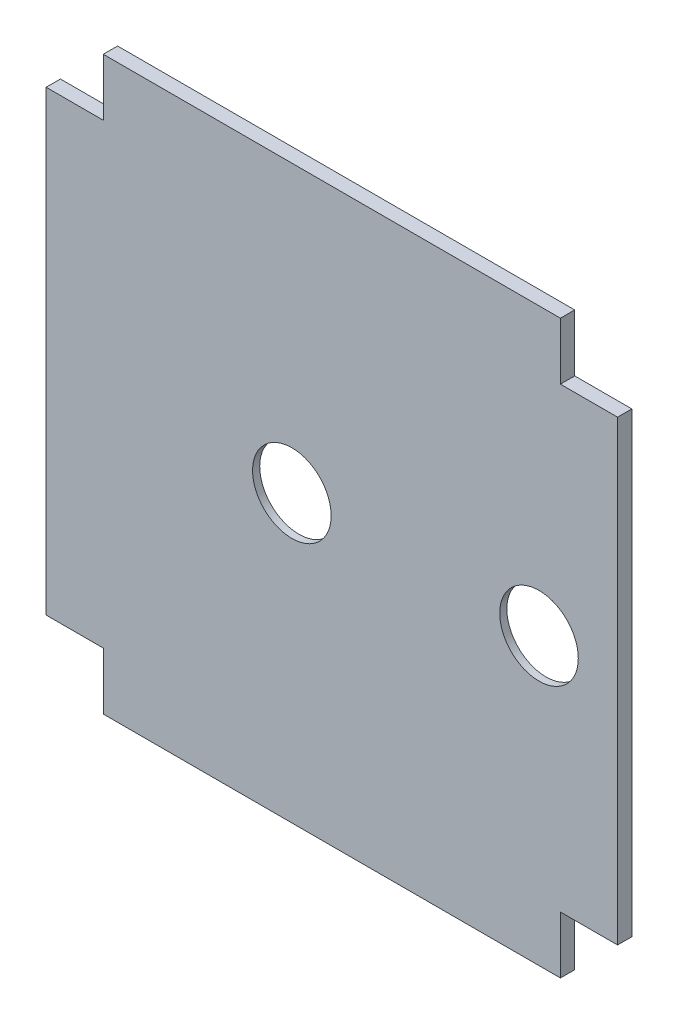
from build123d import *

# Parameters (mm, degrees)
SKETCH1_W           = 400
SKETCH1_H           = 400
BOSS_EXTRUDE1_DEPTH = 10
SKETCH4_R           = 27.5
CUT_EXTRUDE2_DEPTH  = 566.773806393
SKETCH5_R           = 35
CUT_EXTRUDE3_DEPTH  = 5
SKETCH6_W           = 40
SKETCH6_H           = 40
CUT_EXTRUDE4_DEPTH  = 566.773806393


with BuildPart() as part:
    # Sketch1 → Boss-Extrude1 (new body)
    with BuildSketch(Plane.XY):
        with Locations((200, 200)):
            Rectangle(SKETCH1_W, SKETCH1_H)
    extrude(amount=BOSS_EXTRUDE1_DEPTH)

    # Sketch4 → Cut-Extrude2 (cut, through all)
    with BuildSketch(Plane.XY.offset(10)):
        with Locations((345.000168938, 199.966321147)):
            Circle(SKETCH4_R)
        with Locations((172.000168938, 199.966321147)):
            Circle(SKETCH4_R)
    extrude(amount=-CUT_EXTRUDE2_DEPTH, mode=Mode.SUBTRACT)

    # Sketch5 → Cut-Extrude3 (cut)
    with BuildSketch(Plane(origin=(0, 0, 0), x_dir=(-1, 0, 0), z_dir=(0, 0, -1))):
        with Locations((-345.000168938, 199.966321147)):
            Circle(SKETCH5_R)
        with Locations((-172.000168938, 199.966321147)):
            Circle(SKETCH5_R)
    extrude(amount=-CUT_EXTRUDE3_DEPTH, mode=Mode.SUBTRACT)

    # Sketch6 → Cut-Extrude4 (cut, through all)
    with BuildSketch(Plane(origin=(0, 0, 0), x_dir=(-1, 0, 0), z_dir=(0, 0, -1))):
        with Locations((-380, 380)):
            Rectangle(SKETCH6_W, SKETCH6_H)
        with Locations((-380, 20)):
            Rectangle(SKETCH6_W, SKETCH6_H)
        with Locations((-20, 380)):
            Rectangle(SKETCH6_W, SKETCH6_H)
        with Locations((-20, 20)):
            Rectangle(SKETCH6_W, SKETCH6_H)
    extrude(amount=-CUT_EXTRUDE4_DEPTH, mode=Mode.SUBTRACT)


solid = part.part
